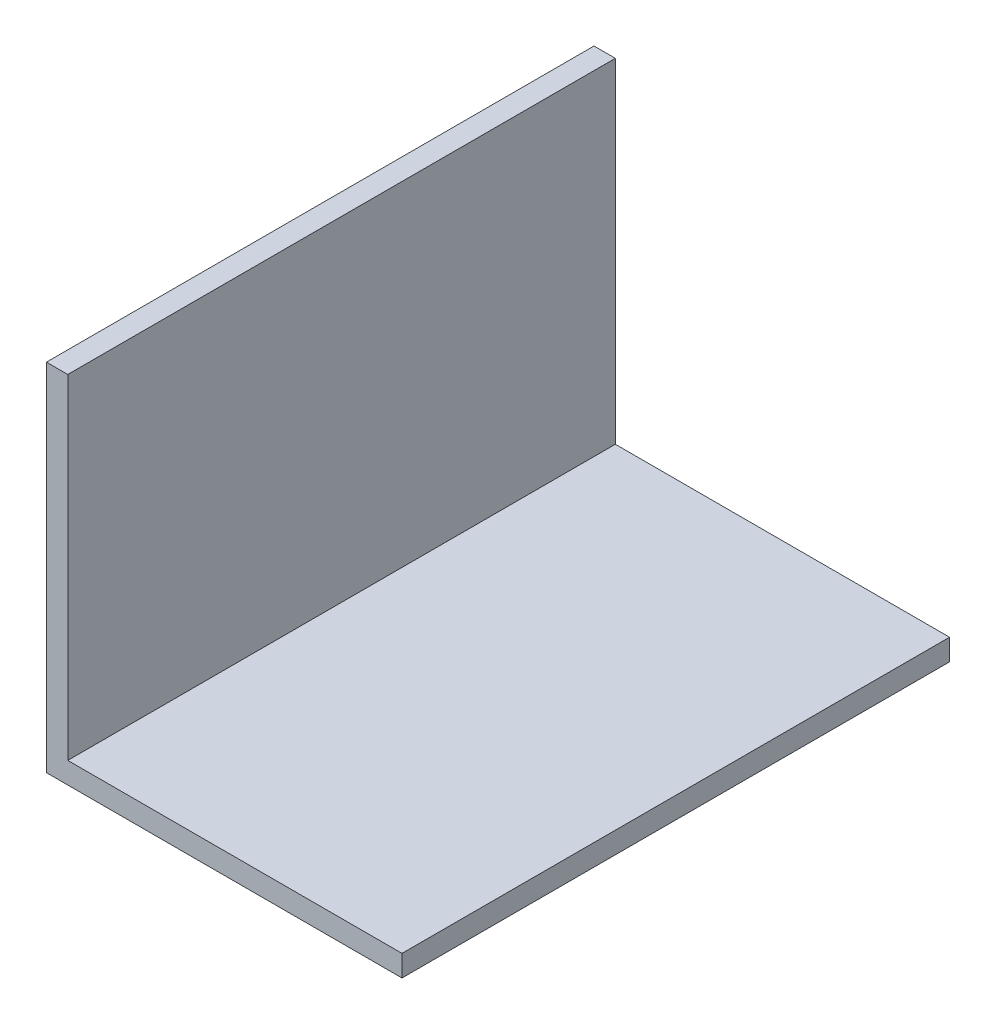
from build123d import *

# Parameters (mm, degrees)
BOSS_EXTRUDE1_DEPTH = 38.5


with BuildPart() as part:
    # Sketch1 → Boss-Extrude1 (new body)
    with BuildSketch(Plane.XY):
        Polygon((0, 0), (0, 25), (1.5, 25), (1.5, 1.5), (25, 1.5), (25, 0), align=None)
    extrude(amount=BOSS_EXTRUDE1_DEPTH)


solid = part.part
